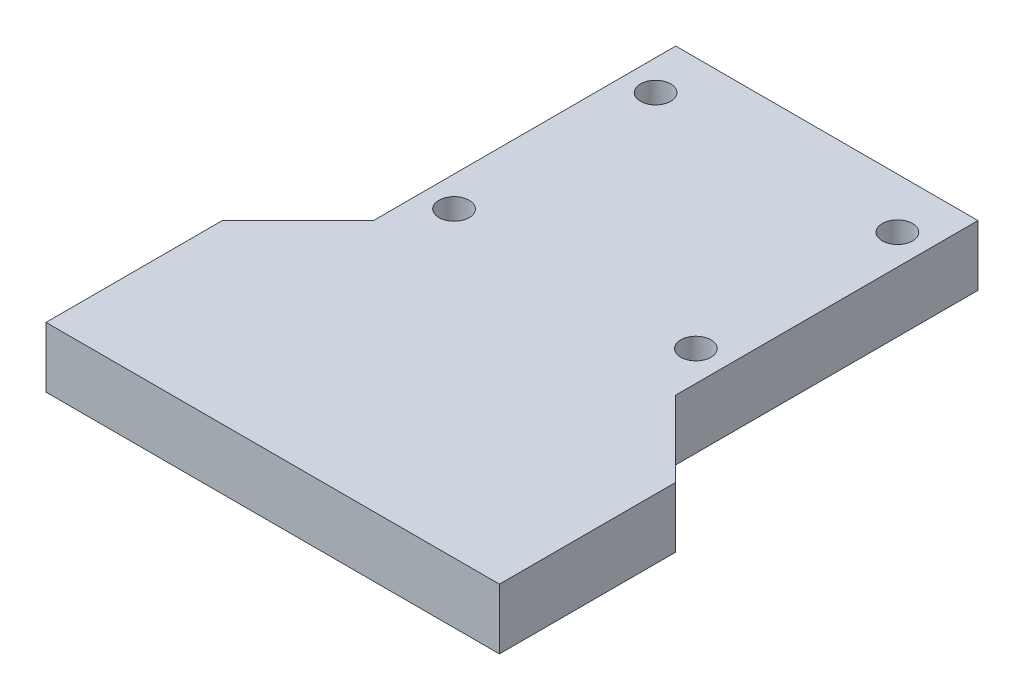
from build123d import *

# Parameters (mm, degrees)
BOSS_EXTRUDE1_DEPTH = 12
CUT_EXTRUDE1_REACH  = 94.569
SKETCH2_R           = 3


with BuildPart() as part:
    # Sketch1 → Boss-Extrude1 (new body)
    with BuildSketch(Plane(origin=(0, 0, 0), x_dir=(1, 0, 0), z_dir=(0, 1, 0))):
        Polygon((-30, -30), (-45, -45), (-45, -80), (45, -80), (45, -45), (30, -30), (30, 30), (-30, 30), align=None)
    extrude(amount=BOSS_EXTRUDE1_DEPTH)

    # Sketch2 → Cut-Extrude1 (cut, up to next)
    with BuildSketch(Plane(origin=(0, 12, 0), x_dir=(1, 0, 0), z_dir=(0, 1, 0)), mode=Mode.PRIVATE) as cut_extrude1_sk1:
        with Locations(Location((-24, 20, 0), (0, 0, 270))):
            Circle(SKETCH2_R)
    cut_extrude1_tool1 = extrude(cut_extrude1_sk1.sketch, amount=-CUT_EXTRUDE1_REACH, mode=Mode.PRIVATE) & part.part
    # Sketch2 → Cut-Extrude1 (cut, up to next)
    with BuildSketch(Plane(origin=(0, 12, 0), x_dir=(1, 0, 0), z_dir=(0, 1, 0)), mode=Mode.PRIVATE) as cut_extrude1_sk2:
        with Locations(Location((-24, -20, 0), (0, 0, 270))):
            Circle(SKETCH2_R)
    cut_extrude1_tool2 = extrude(cut_extrude1_sk2.sketch, amount=-CUT_EXTRUDE1_REACH, mode=Mode.PRIVATE) & part.part
    # Sketch2 → Cut-Extrude1 (cut, up to next)
    with BuildSketch(Plane(origin=(0, 12, 0), x_dir=(1, 0, 0), z_dir=(0, 1, 0)), mode=Mode.PRIVATE) as cut_extrude1_sk3:
        with Locations(Location((24, 20, 0), (0, 0, 270))):
            Circle(SKETCH2_R)
    cut_extrude1_tool3 = extrude(cut_extrude1_sk3.sketch, amount=-CUT_EXTRUDE1_REACH, mode=Mode.PRIVATE) & part.part
    # Sketch2 → Cut-Extrude1 (cut, up to next)
    with BuildSketch(Plane(origin=(0, 12, 0), x_dir=(1, 0, 0), z_dir=(0, 1, 0)), mode=Mode.PRIVATE) as cut_extrude1_sk4:
        with Locations(Location((24, -20, 0), (0, 0, 270))):
            Circle(SKETCH2_R)
    cut_extrude1_tool4 = extrude(cut_extrude1_sk4.sketch, amount=-CUT_EXTRUDE1_REACH, mode=Mode.PRIVATE) & part.part
    add(cut_extrude1_tool1.solids().sort_by_distance((-24, 12, -20))[0], mode=Mode.SUBTRACT)
    add(cut_extrude1_tool2.solids().sort_by_distance((-24, 12, 20))[0], mode=Mode.SUBTRACT)
    add(cut_extrude1_tool3.solids().sort_by_distance((24, 12, -20))[0], mode=Mode.SUBTRACT)
    add(cut_extrude1_tool4.solids().sort_by_distance((24, 12, 20))[0], mode=Mode.SUBTRACT)


solid = part.part
